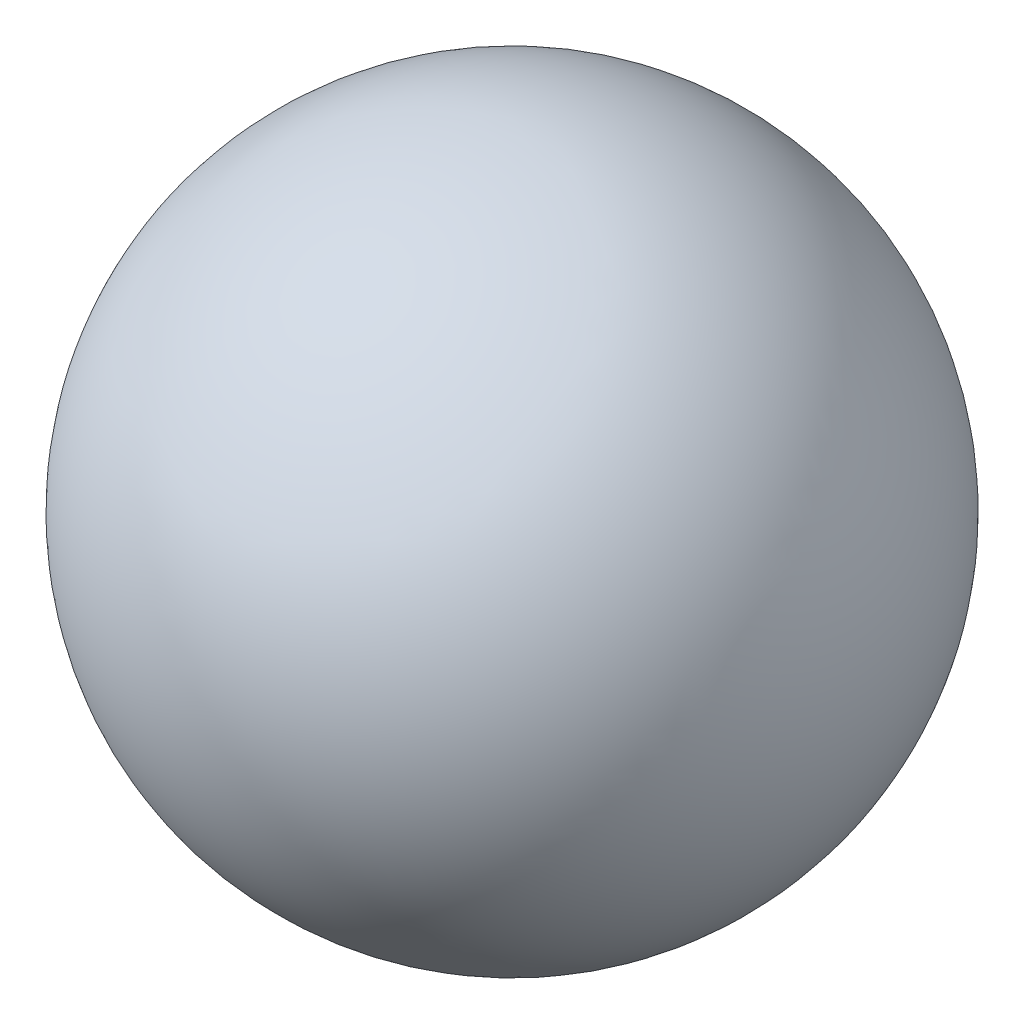
from build123d import *


with BuildPart() as part:
    # Esquisse1 → Base-Révolution (revolve)
    with BuildSketch(Plane(origin=(0, 0, 0), x_dir=(1, 0, 0), z_dir=(0, 1, 0))):
        with BuildLine():
            Line((2, 4.2), (7.4, 4.2))
            ThreePointArc((7.4, 4.2), (4.7, 6.9), (2, 4.2))
        make_face()
    revolve(axis=Axis((-0.3, 0, -4.2), (1, 0, 0)))


solid = part.part
